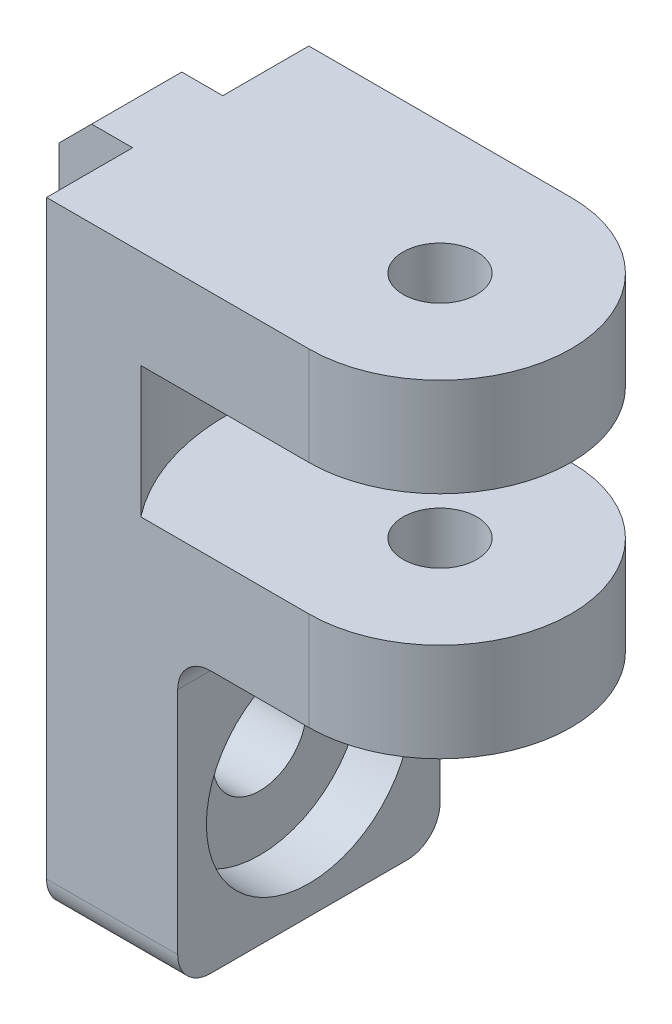
from build123d import *

# Parameters (mm, degrees)
SKETCH1_W           = 16
SKETCH1_H           = 38
BOSS_EXTRUDE1_DEPTH = 8
SKETCH2_W           = 5.5
SKETCH2_H           = 22
BOSS_EXTRUDE2_DEPTH = 4.5
SKETCH6_R           = 2.25
BOSS_EXTRUDE3_DEPTH = 20
FILLET6_R           = 2
CHAMFER1_SIZE       = 2
SKETCH7_R           = 2.85
CUT_EXTRUDE1_DEPTH  = 10
SKETCH8_R           = 6.25
CUT_EXTRUDE2_DEPTH  = 3
CUT_EXTRUDE3_START  = -10
SKETCH9_R           = 13
CUT_EXTRUDE3_DEPTH  = 4
FILLET7_R           = 2


with BuildPart() as part:
    # Sketch1 → Boss-Extrude1 (new body)
    with BuildSketch(Plane(origin=(0, 0, 0), x_dir=(0, 0, -1), z_dir=(1, 0, 0))):
        with Locations((-40.846556001, 16.91146402)):
            Rectangle(SKETCH1_W, SKETCH1_H)
    extrude(amount=BOSS_EXTRUDE1_DEPTH)

    # Sketch2 → Boss-Extrude2 (add)
    with BuildSketch(Plane.ZY):
        with Locations((40.846556001, 24.91146402)):
            Rectangle(SKETCH2_W, SKETCH2_H)
    extrude(amount=BOSS_EXTRUDE2_DEPTH)

    # Sketch6 → Boss-Extrude3 (add)
    with BuildSketch(Plane.XZ.offset(-35.91146402)):
        with BuildLine():
            Line((8, 48.846556001), (16, 48.846556001))
            ThreePointArc((16, 48.846556001), (24, 40.846556001), (16, 32.846556001))
            Line((16, 32.846556001), (8, 32.846556001))
            Line((8, 32.846556001), (8, 48.846556001))
        make_face()
        with Locations(Location((16, 40.846556001, 0), (0, 0, 270))):
            Circle(SKETCH6_R, mode=Mode.SUBTRACT)
    extrude(amount=BOSS_EXTRUDE3_DEPTH)

    # Fillet6
    fillet6_edges = [part.edges().sort_by_distance(p)[0] for p in [
        (8, 15.91146402, 40.846556001),
    ]]
    fillet(fillet6_edges, radius=FILLET6_R)

    # Chamfer1
    chamfer1_edges = [part.edges().sort_by_distance(p)[0] for p in [
        (-4.5, 13.91146402, 40.846556001),
        (-4.5, 35.91146402, 40.846556001),
    ]]
    chamfer(chamfer1_edges, length=CHAMFER1_SIZE)

    # Sketch7 → Cut-Extrude1 (cut)
    with BuildSketch(Plane(origin=(8, 0, 0), x_dir=(0, 0, -1), z_dir=(1, 0, 0))):
        with Locations((-40.846556001, 5.91146402)):
            Circle(SKETCH7_R)
    extrude(amount=-CUT_EXTRUDE1_DEPTH, mode=Mode.SUBTRACT)

    # Sketch8 → Cut-Extrude2 (cut)
    with BuildSketch(Plane(origin=(8, 0, 0), x_dir=(0, 0, -1), z_dir=(1, 0, 0))):
        with Locations((-40.846556001, 5.91146402)):
            Circle(SKETCH8_R)
    extrude(amount=-CUT_EXTRUDE2_DEPTH, mode=Mode.SUBTRACT)

    # Sketch9 → Cut-Extrude3 (cut, symmetric)
    with BuildSketch(Plane(origin=(0, 35.91146402, 0), x_dir=(1, 0, 0), z_dir=(0, 1, 0)).offset(CUT_EXTRUDE3_START)):
        with Locations((16, -40.846556001)):
            Circle(SKETCH9_R)
    extrude(amount=CUT_EXTRUDE3_DEPTH, both=True, mode=Mode.SUBTRACT)

    # Fillet7
    fillet7_edges = [part.edges().sort_by_distance(p)[0] for p in [
        (4, -2.08853598, 32.846556001),
        (4, -2.08853598, 48.846556001),
    ]]
    fillet(fillet7_edges, radius=FILLET7_R)


solid = part.part
